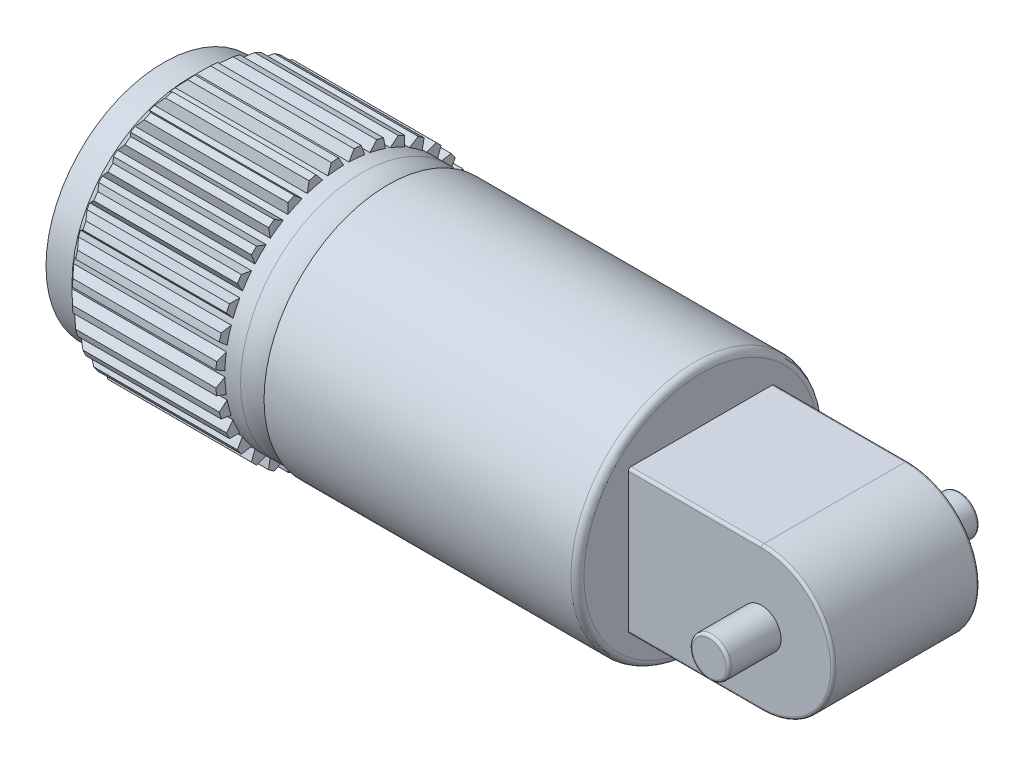
from build123d import *
from build123d.topology import SkipClean

# Parameters (mm, degrees)
FILLET_1_R               = 0.25
EXTRUDE_1_DEPTH          = 2.8
FILLET_2_R               = 0.1
SKETCH_3_R               = 0.75
EXTRUDE_2_DEPTH          = 2
FILLET_3_R               = 0.1
FILLET_3_OF_MIRROR_1_R   = 0.1
CUT_EXTRUDE_1_DEPTH      = 23.58544895
PATTERN_CIRCULAR_1_COUNT = 36


with BuildPart() as part:
    # Эскиз1 → Повернуть1 (revolve)
    with BuildSketch(Plane.XY, mode=Mode.PRIVATE) as revolve_1_sk:
        with BuildLine():
            Line((1, 0), (20.6, 0))
            Line((20.6, 0), (20.6, 4.75))
            Line((20.6, 4.75), (8.6, 4.75))
            Line((8.6, 4.75), (8.6, 4.2989996))
            ThreePointArc((8.6, 4.2989996), (8.129905954, 4.559701851), (7.6, 4.65))
            Line((7.6, 4.65), (7, 4.65))
            Line((7, 4.65), (7, 5))
            Line((7, 5), (1.5, 5))
            Line((1.5, 5), (1, 4.5))
            Line((1, 4.5), (0, 4.5))
            Line((0, 4.5), (0, 3.3))
            Line((0, 3.3), (1, 3.3))
            Line((1, 3.3), (1, 2.62))
            Line((1, 2.62), (5, 2.62))
            Line((5, 2.62), (5, 2.35))
            Line((5, 2.35), (3, 2.35))
            Line((3, 2.35), (3, 2.25))
            Line((3, 2.25), (3.05, 2.25))
            Line((3.05, 2.25), (3.05, 0.45))
            Line((3.05, 0.45), (1.45, 0.45))
            ThreePointArc((1.45, 0.45), (1.131801948, 0.318198052), (1, 0))
        make_face()
    revolve(revolve_1_sk.sketch.rotate(Axis((1, 0, 0), (1, 0, 0)), 90), axis=Axis((1, 0, 0), (1, 0, 0)))

    # Скругление1
    fillet_1_edges = [part.edges().sort_by_distance(p)[0] for p in [
        (20.6, 0, -4.75),
    ]]
    fillet(fillet_1_edges, radius=FILLET_1_R)

    # Эскиз2 → Бобышка-Вытянуть1 (add, symmetric)
    with BuildSketch(Plane.XY):
        with BuildLine():
            Line((20.6, -2.75), (25.7, -2.75))
            ThreePointArc((25.7, -2.75), (28.45, 0), (25.7, 2.75))
            Line((25.7, 2.75), (20.6, 2.75))
            Line((20.6, 2.75), (20.6, -2.75))
        make_face()
    extrude(amount=EXTRUDE_1_DEPTH, both=True)

    # Скругление2
    fillet_2_edges = [part.edges().sort_by_distance(p)[0] for p in [
        (23.15, -2.75, -2.8),
        (28.45, 0, -2.8),
        (23.15, 2.75, -2.8),
        (23.15, -2.75, 2.8),
        (28.45, 0, 2.8),
        (23.15, 2.75, 2.8),
    ]]
    fillet(fillet_2_edges, radius=FILLET_2_R)

    # Эскиз3 → Бобышка-Вытянуть2 (add)
    with BuildSketch(Plane.XY.offset(2.8)):
        with Locations((25.7, 0)):
            Circle(SKETCH_3_R)
    extrude_2 = extrude(amount=EXTRUDE_2_DEPTH)

    # Скругление3
    fillet_3_edges = [part.edges().sort_by_distance(p)[0] for p in [
        (24.95, 0, 4.8),
    ]]
    fillet(fillet_3_edges, radius=FILLET_3_R)

    # Зеркальное отражение1: Бобышка-Вытянуть2 across plane
    add(extrude_2.mirror(Plane.XY))

    # Скругление3 of Зеркальное отражение1
    fillet_3_of_mirror_1_edges = [part.edges().sort_by_distance(p)[0] for p in [
        (24.95, 0, -4.8),
    ]]
    fillet(fillet_3_of_mirror_1_edges, radius=FILLET_3_OF_MIRROR_1_R)

    # Эскиз4 → Вырез-Вытянуть1 (cut, through all)
    with BuildSketch(Plane(origin=(7, 0, 0), x_dir=(0, 0, -1), z_dir=(1, 0, 0))):
        with BuildLine():
            Line((-0.3, 4.990991885), (-0.102476231, 4.648870682))
            ThreePointArc((-0.102476231, 4.648870682), (0, 4.65), (0.102476231, 4.648870682))
            Line((0.102476231, 4.648870682), (0.3, 4.990991885))
            ThreePointArc((0.3, 4.990991885), (0, 5), (-0.3, 4.990991885))
        make_face()
    cut_extrude_1 = extrude(amount=-CUT_EXTRUDE_1_DEPTH, mode=Mode.SUBTRACT)

    # Круговой массив1: Вырез-Вытянуть1 ×36 about axis
    with SkipClean():  # the faces are left unmerged after this step: merging them gives an invalid solid
        pattern_circular_1_axis = Axis((0, 0, 0), (1, 0, 0))
        for i in range(1, PATTERN_CIRCULAR_1_COUNT):
            add(cut_extrude_1.rotate(pattern_circular_1_axis, i * 360 / PATTERN_CIRCULAR_1_COUNT), mode=Mode.SUBTRACT)


solid = part.part
